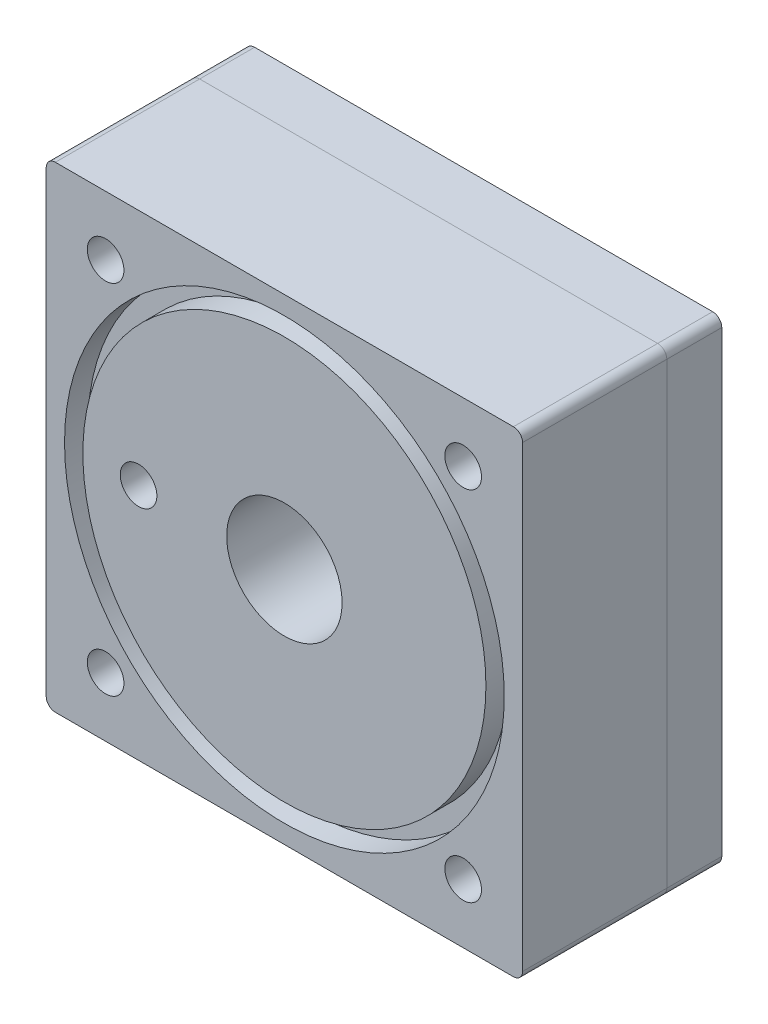
from build123d import *

# Parameters (mm, degrees)
SKETCH1_W                        = 165.1
SKETCH1_H                        = 165.1
BOSS_EXTRUDE1_DEPTH              = 50
SKETCH2_R                        = 40
BOSS_EXTRUDE2_DEPTH              = 50.8
SKETCH4_R                        = 32
CUT_EXTRUDE1_DEPTH               = 28
SKETCH5_R                        = 30
CUT_EXTRUDE2_DEPTH               = 22
FILLET1_R                        = 3.175
SKETCH6_R                        = 20
CUT_EXTRUDE4_DEPTH               = 40
SKETCH7_R                        = 76.2
SKETCH7_R_2                      = 69.85
CUT_EXTRUDE5_DEPTH               = 8
F_1_2_14_NPSM_TAPPED_HOLE1_D     = 18.9738
F_1_2_14_NPSM_TAPPED_HOLE1_DEPTH = 47.24
F_1_2_14_NPSM_TAPPED_HOLE1_TIP   = 5.700304607
SKETCH11_R                       = 6.35
CUT_EXTRUDE6_DEPTH               = 25
SKETCH12_R                       = 6.35
CUT_EXTRUDE7_DEPTH               = 155.23892186
SKETCH13_R                       = 40
SKETCH13_R_2                     = 6.35
BOSS_EXTRUDE3_DEPTH              = 19.05


with BuildPart() as part:
    # Sketch1 → Boss-Extrude1 (new body)
    with BuildSketch(Plane.XY):
        Rectangle(SKETCH1_W, SKETCH1_H)
    extrude(amount=BOSS_EXTRUDE1_DEPTH)

    # Sketch2 → Boss-Extrude2 (add)
    with BuildSketch(Plane(origin=(0, 0, 0), x_dir=(-1, 0, 0), z_dir=(0, 0, -1))):
        Circle(SKETCH2_R)
    extrude(amount=BOSS_EXTRUDE2_DEPTH)

    # Sketch4 → Cut-Extrude1 (cut)
    with BuildSketch(Plane(origin=(0, 0, -50.8), x_dir=(-1, 0, 0), z_dir=(0, 0, -1))):
        Circle(SKETCH4_R)
    extrude(amount=-CUT_EXTRUDE1_DEPTH, mode=Mode.SUBTRACT)

    # Sketch5 → Cut-Extrude2 (cut)
    with BuildSketch(Plane(origin=(0, 0, -22.8), x_dir=(-1, 0, 0), z_dir=(0, 0, -1))):
        Circle(SKETCH5_R)
    extrude(amount=-CUT_EXTRUDE2_DEPTH, mode=Mode.SUBTRACT)

    # Fillet1
    fillet1_edges = [part.edges().sort_by_distance(p)[0] for p in [
        (-82.55, 82.55, 25),
        (82.55, 82.55, 25),
        (82.55, -82.55, 25),
        (-82.55, -82.55, 25),
    ]]
    fillet(fillet1_edges, radius=FILLET1_R)

    # Sketch6 → Cut-Extrude4 (cut)
    with BuildSketch(Plane.XY.offset(50)):
        Circle(SKETCH6_R)
    extrude(amount=-CUT_EXTRUDE4_DEPTH, mode=Mode.SUBTRACT)

    # Sketch7 → Cut-Extrude5 (cut)
    with BuildSketch(Plane.XY.offset(50)):
        Circle(SKETCH7_R)
        Circle(SKETCH7_R_2, mode=Mode.SUBTRACT)
    extrude(amount=-CUT_EXTRUDE5_DEPTH, mode=Mode.SUBTRACT)

    # 1/2-14 NPSM Tapped Hole1
    with Locations(Plane.ZY.offset(82.55)):
        with Locations((25, 0)):
            Hole(F_1_2_14_NPSM_TAPPED_HOLE1_D / 2, depth=F_1_2_14_NPSM_TAPPED_HOLE1_DEPTH)
            with Locations((0, 0, -(F_1_2_14_NPSM_TAPPED_HOLE1_DEPTH + F_1_2_14_NPSM_TAPPED_HOLE1_TIP / 2))):  # 118° drill point
                Cone(0, F_1_2_14_NPSM_TAPPED_HOLE1_D / 2, F_1_2_14_NPSM_TAPPED_HOLE1_TIP, mode=Mode.SUBTRACT)

    # Sketch11 → Cut-Extrude6 (cut)
    with BuildSketch(Plane.XY.offset(50)):
        with Locations((-50.55, 0)):
            Circle(SKETCH11_R)
    extrude(amount=-CUT_EXTRUDE6_DEPTH, mode=Mode.SUBTRACT)

    # Sketch12 → Cut-Extrude7 (cut, through all)
    with BuildSketch(Plane.XY.offset(50)):
        with Locations((-61.963767235, 61.963767235)):
            Circle(SKETCH12_R)
        with Locations((61.963767235, 61.963767235)):
            Circle(SKETCH12_R)
        with Locations((61.963767235, -61.963767235)):
            Circle(SKETCH12_R)
        with Locations((-61.963767235, -61.963767235)):
            Circle(SKETCH12_R)
    extrude(amount=-CUT_EXTRUDE7_DEPTH, mode=Mode.SUBTRACT)


with BuildPart() as body_2:
    # Sketch13 → Boss-Extrude3 (new body)
    with BuildSketch(Plane(origin=(0, 0, 0), x_dir=(-1, 0, 0), z_dir=(0, 0, -1))):
        with BuildLine():
            Line((-79.375, 82.55), (79.375, 82.55))
            ThreePointArc((79.375, 82.55), (81.62006403, 81.62006403), (82.55, 79.375))
            Line((82.55, 79.375), (82.55, -79.375))
            ThreePointArc((82.55, -79.375), (81.62006403, -81.62006403), (79.375, -82.55))
            Line((79.375, -82.55), (-79.375, -82.55))
            ThreePointArc((-79.375, -82.55), (-81.62006403, -81.62006403), (-82.55, -79.375))
            Line((-82.55, -79.375), (-82.55, 79.375))
            ThreePointArc((-82.55, 79.375), (-81.62006403, 81.62006403), (-79.375, 82.55))
        make_face()
        with Locations(Location((0, 0, 0), (0, 0, 180))):
            Circle(SKETCH13_R, mode=Mode.SUBTRACT)
        with Locations(Location((61.963767235, 61.963767235, 0), (0, 0, 180))):
            Circle(SKETCH13_R_2, mode=Mode.SUBTRACT)
        with Locations(Location((-61.963767235, 61.963767235, 0), (0, 0, 180))):
            Circle(SKETCH13_R_2, mode=Mode.SUBTRACT)
        with Locations(Location((-61.963767235, -61.963767235, 0), (0, 0, 180))):
            Circle(SKETCH13_R_2, mode=Mode.SUBTRACT)
        with Locations(Location((61.963767235, -61.963767235, 0), (0, 0, 180))):
            Circle(SKETCH13_R_2, mode=Mode.SUBTRACT)
    extrude(amount=BOSS_EXTRUDE3_DEPTH)


solid = Compound([part.part, body_2.part])
